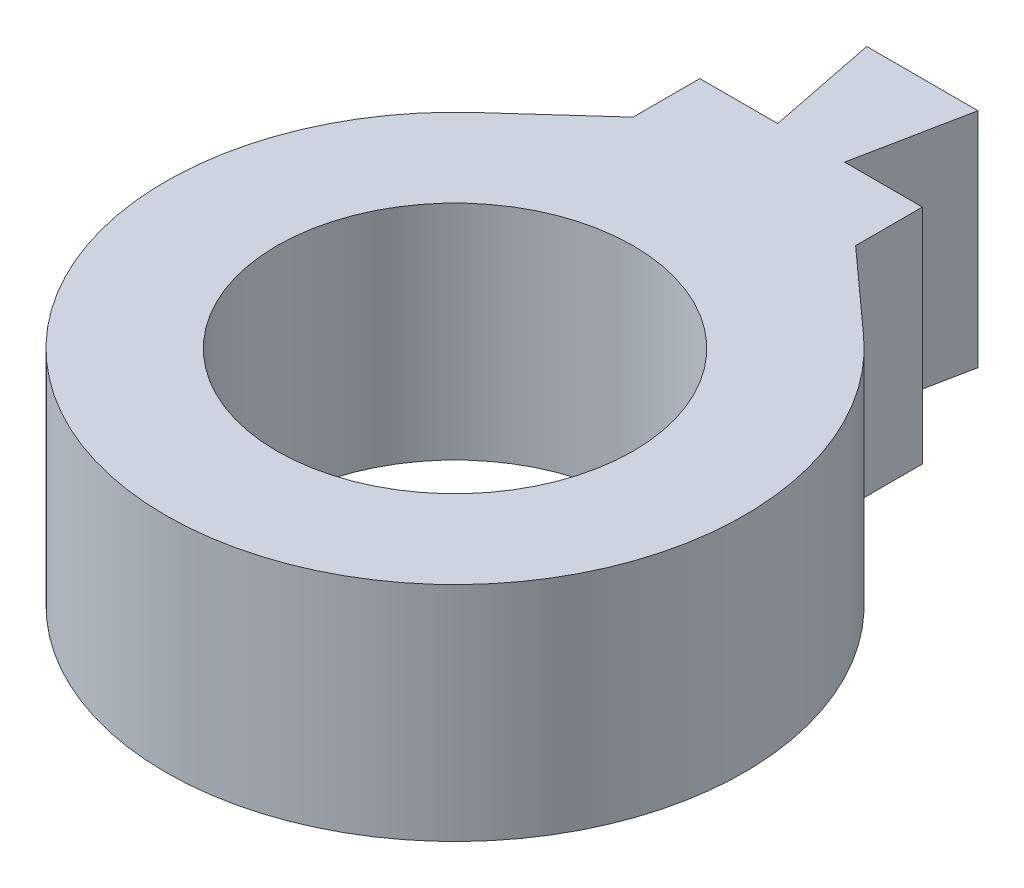
from build123d import *

# Parameters (mm, degrees)
SKETCH1_R           = 13
SKETCH1_R_2         = 8
BOSS_EXTRUDE1_DEPTH = 10


with BuildPart() as part:
    # Sketch1 → Boss-Extrude1 (new body)
    # profile 1 of 5: a face of its own
    with BuildSketch(Plane(origin=(0, 0, 0), x_dir=(1, 0, 0), z_dir=(0, 1, 0))):
        with Locations((5, -16)):
            Circle(SKETCH1_R)
        with Locations(Location((5, -16, 0), (0, 0, 270))):
            Circle(SKETCH1_R_2, mode=Mode.SUBTRACT)
    # profile 2 of 5: a face of its own
    with BuildSketch(Plane(origin=(0, 0, 0), x_dir=(1, 0, 0), z_dir=(0, 1, 0))):
        with BuildLine():
            Line((10, -3), (5, -3))
            ThreePointArc((5, -3), (9.666728031, -3.866507119), (13.711340206, -6.350515464))
            Line((13.711340206, -6.350515464), (10, -3))
        make_face()
    # profile 3 of 5: a face of its own
    with BuildSketch(Plane(origin=(0, 0, 0), x_dir=(1, 0, 0), z_dir=(0, 1, 0))):
        Polygon((7.5, 5), (5, 5), (5, -3), (10, -3), (10, 0), (6.5, 0), align=None)
    # profile 4 of 5: a face of its own
    with BuildSketch(Plane(origin=(0, 0, 0), x_dir=(1, 0, 0), z_dir=(0, 1, 0))):
        Polygon((2.5, 5), (3.5, 0), (0, 0), (0, -3), (5, -3), (5, 5), align=None)
    # profile 5 of 5: a face of its own
    with BuildSketch(Plane(origin=(0, 0, 0), x_dir=(1, 0, 0), z_dir=(0, 1, 0))):
        with BuildLine():
            Line((5, -3), (0, -3))
            Line((0, -3), (-3.711340206, -6.350515464))
            ThreePointArc((-3.711340206, -6.350515464), (0.333271969, -3.866507119), (5, -3))
        make_face()
    extrude(amount=BOSS_EXTRUDE1_DEPTH)


solid = part.part
